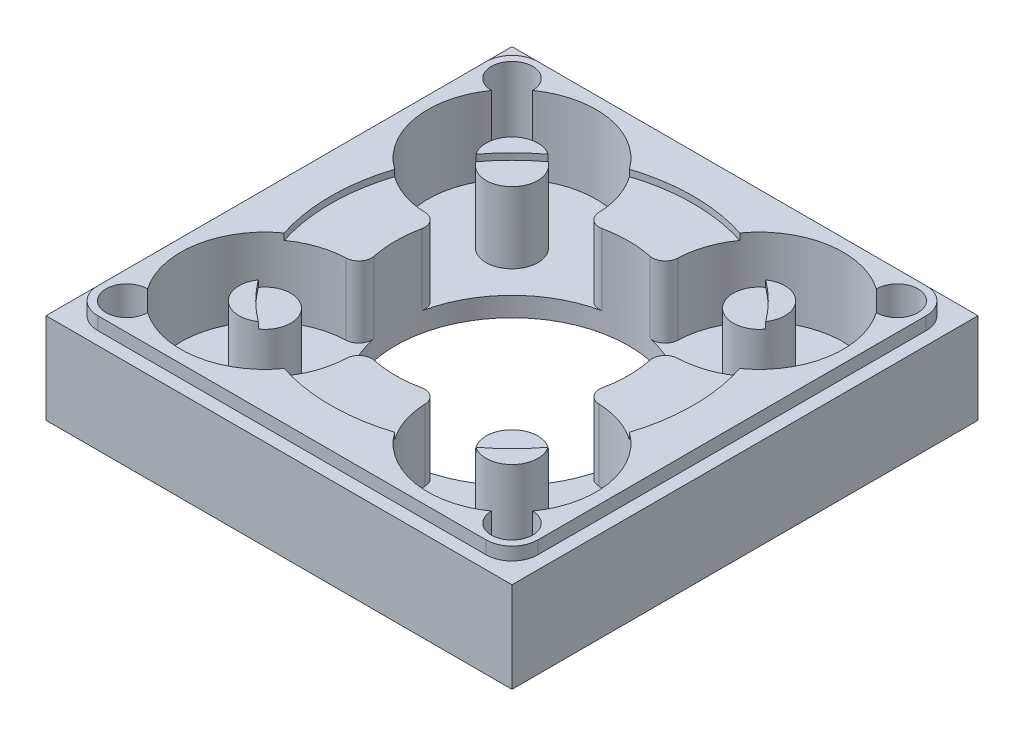
from build123d import *

# Parameters (mm, degrees)
SKETCH1_W          = 57.15
SKETCH1_H          = 57.15
SKETCH1_R          = 14.2875
STOCK_DEPTH        = 12.7
SKETCH6_R          = 2.54
MOUNT_HOLES_DEPTH  = 43.359783404
SKETCH2_W          = 57.15
SKETCH2_H          = 57.15
LIP_DEPTH          = 1.5875
SKETCH4_R          = 10.31875
SKETCH4_R_2        = 3.175
BEARING_CUTS_DEPTH = 9.525
SKETCH5_R          = 22.225
INNER_RACE_DEPTH   = 0.79375
OUTER_START        = -0.79375
SKETCH8_R          = 22.225
OUTER_RACE_DEPTH   = 0.79375
FILLET1_R          = 1.5875


with BuildPart() as part:
    # Sketch1 → Stock (new body)
    with BuildSketch(Plane(origin=(0, 0, 0), x_dir=(1, 0, 0), z_dir=(0, 1, 0))):
        Rectangle(SKETCH1_W, SKETCH1_H)
        with Locations(Location((0, 0, 0), (0, 0, 270))):
            Circle(SKETCH1_R, mode=Mode.SUBTRACT)
    extrude(amount=STOCK_DEPTH)

    # Sketch6 → Mount Holes (cut, through all)
    with BuildSketch(Plane.XZ):
        with Locations(Location((-23.622, 23.622, 0), (0, 0, 270))):
            Circle(SKETCH6_R)
        with Locations(Location((23.622, 23.622, 0), (0, 0, 270))):
            Circle(SKETCH6_R)
        with Locations(Location((23.622, -23.622, 0), (0, 0, 270))):
            Circle(SKETCH6_R)
        with Locations(Location((-23.622, -23.622, 0), (0, 0, 270))):
            Circle(SKETCH6_R)
    extrude(amount=-MOUNT_HOLES_DEPTH, mode=Mode.SUBTRACT)

    # Sketch2 → Lip (cut)
    with BuildSketch(Plane(origin=(0, 12.7, 0), x_dir=(1, 0, 0), z_dir=(0, 1, 0))):
        Rectangle(SKETCH2_W, SKETCH2_H)
        with BuildLine():
            Line((-23.8125, -26.9875), (23.8125, -26.9875))
            ThreePointArc((23.8125, -26.9875), (26.05756403, -26.05756403), (26.9875, -23.8125))
            Line((26.9875, -23.8125), (26.9875, 23.8125))
            ThreePointArc((26.9875, 23.8125), (26.05756403, 26.05756403), (23.8125, 26.9875))
            Line((23.8125, 26.9875), (-23.8125, 26.9875))
            ThreePointArc((-23.8125, 26.9875), (-26.05756403, 26.05756403), (-26.9875, 23.8125))
            Line((-26.9875, 23.8125), (-26.9875, -23.8125))
            ThreePointArc((-26.9875, -23.8125), (-26.05756403, -26.05756403), (-23.8125, -26.9875))
        make_face(mode=Mode.SUBTRACT)
    extrude(amount=-LIP_DEPTH, mode=Mode.SUBTRACT)

    # Sketch4 → Bearing Cuts (cut)
    # profile 1 of 4: a face of its own
    with BuildSketch(Plane(origin=(0, 12.7, 0), x_dir=(1, 0, 0), z_dir=(0, 1, 0))):
        with Locations((15.154182204, 15.154182204)):
            Circle(SKETCH4_R)
        with Locations(Location((15.154182204, 15.154182204, 0), (0, 0, 270))):
            Circle(SKETCH4_R_2, mode=Mode.SUBTRACT)
    # profile 2 of 4: a face of its own
    with BuildSketch(Plane(origin=(0, 12.7, 0), x_dir=(1, 0, 0), z_dir=(0, 1, 0))):
        with Locations((15.154182204, -15.154182204)):
            Circle(SKETCH4_R)
        with Locations(Location((15.154182204, -15.154182204, 0), (0, 0, 270))):
            Circle(SKETCH4_R_2, mode=Mode.SUBTRACT)
    # profile 3 of 4: a face of its own
    with BuildSketch(Plane(origin=(0, 12.7, 0), x_dir=(1, 0, 0), z_dir=(0, 1, 0))):
        with Locations((-15.154182204, -15.154182204)):
            Circle(SKETCH4_R)
        with Locations(Location((-15.154182204, -15.154182204, 0), (0, 0, 270))):
            Circle(SKETCH4_R_2, mode=Mode.SUBTRACT)
    # profile 4 of 4: a face of its own
    with BuildSketch(Plane(origin=(0, 12.7, 0), x_dir=(1, 0, 0), z_dir=(0, 1, 0))):
        with Locations((-15.154182204, 15.154182204)):
            Circle(SKETCH4_R)
        with Locations(Location((-15.154182204, 15.154182204, 0), (0, 0, 270))):
            Circle(SKETCH4_R_2, mode=Mode.SUBTRACT)
    extrude(amount=-BEARING_CUTS_DEPTH, mode=Mode.SUBTRACT)

    # Sketch5 → Inner Race (cut)
    with BuildSketch(Plane(origin=(0, 12.7, 0), x_dir=(1, 0, 0), z_dir=(0, 1, 0))):
        Circle(SKETCH5_R)
    extrude(amount=-INNER_RACE_DEPTH, mode=Mode.SUBTRACT)

    # Sketch8 → Outer Race (cut)
    with BuildSketch(Plane.XZ.offset(OUTER_START)):
        with Locations(Location((0, 0, 0), (0, 0, 270))):
            Circle(SKETCH8_R)
    extrude(amount=OUTER_RACE_DEPTH, mode=Mode.SUBTRACT)

    # Fillet1
    fillet1_edges = [part.edges().sort_by_distance(p)[0] for p in [
        (-13.388674142, 7.540625, 4.987590699),
        (-4.987590699, 7.540625, -13.388674142),
        (-13.388674142, 7.540625, -4.987590699),
        (-4.987590699, 7.540625, 13.388674142),
        (13.388674142, 7.540625, 4.987590699),
        (4.987590699, 7.540625, -13.388674142),
        (13.388674142, 7.540625, -4.987590699),
        (4.987590699, 7.540625, 13.388674142),
    ]]
    fillet(fillet1_edges, radius=FILLET1_R)


solid = part.part
